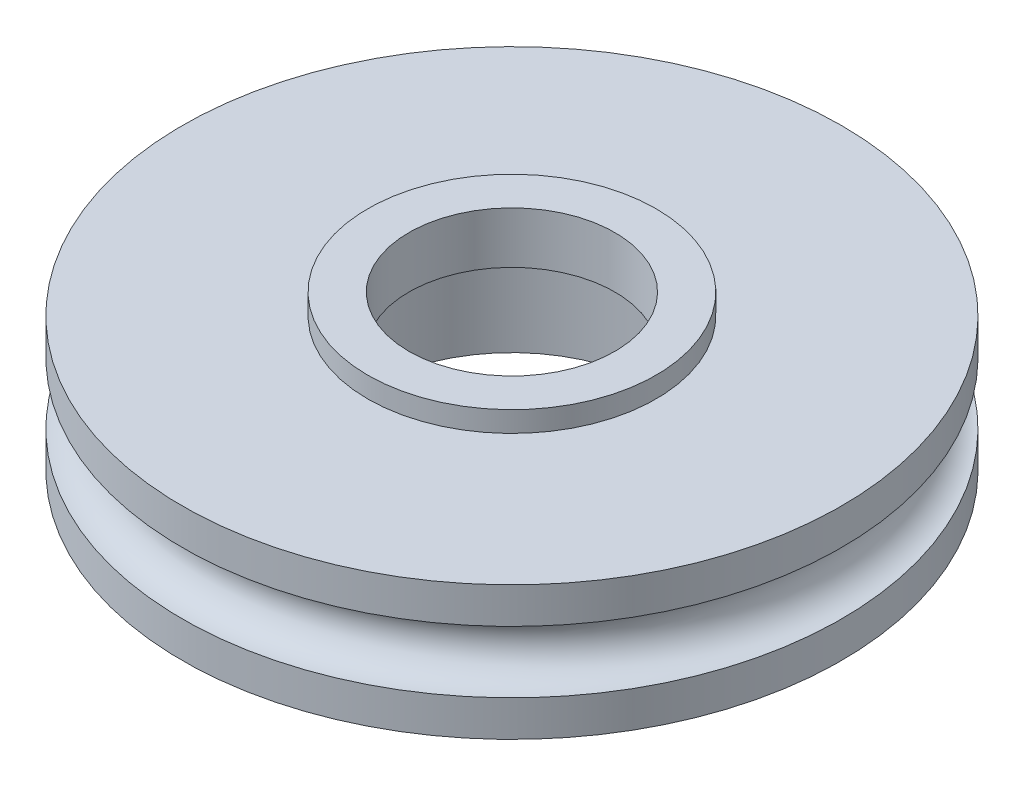
from build123d import *

# Parameters (mm, degrees)
SKETCH1_R           = 8
SKETCH1_R_2         = 3.5
BOSS_EXTRUDE1_DEPTH = 1.625
BOSS_EXTRUDE2_START = -0.75
SKETCH3_R           = 3.5
SKETCH3_R_2         = 2.5
BOSS_EXTRUDE2_DEPTH = 0.75
SKETCH4_R           = 3.5
SKETCH4_R_2         = 2.5
BOSS_EXTRUDE3_DEPTH = 0.5


with BuildPart() as part:
    # Sketch1 → Boss-Extrude1 (new, symmetric)
    with BuildSketch(Plane(origin=(0, 0, 0), x_dir=(1, 0, 0), z_dir=(0, 1, 0))):
        with Locations(Location((0, 0, 0), (0, 0, 90))):
            Circle(SKETCH1_R)
        with Locations(Location((0, 0, 0), (0, 0, 90))):
            Circle(SKETCH1_R_2, mode=Mode.SUBTRACT)
    extrude(amount=BOSS_EXTRUDE1_DEPTH, both=True)

    # Sketch2 → Cut-Revolve1 (revolve, cut)
    with BuildSketch(Plane(origin=(0, 0, 0), x_dir=(0, 0, -1), z_dir=(1, 0, 0)), mode=Mode.PRIVATE) as cut_revolve1_sk:
        with BuildLine():
            Line((-8, 0.75), (-8, -0.75))
            ThreePointArc((-8, -0.75), (-7.25, 0), (-8, 0.75))
        make_face()
    revolve(cut_revolve1_sk.sketch.rotate(Axis((0, 1.625, 0), (0, -1, 0)), 180), axis=Axis((0, 1.625, 0), (0, -1, 0)), mode=Mode.SUBTRACT)

    # Sketch3 → Boss-Extrude2 (add)
    with BuildSketch(Plane(origin=(0, 1.625, 0), x_dir=(1, 0, 0), z_dir=(0, 1, 0)).offset(BOSS_EXTRUDE2_START)):
        with Locations(Location((0, 0, 0), (0, 0, 90))):
            Circle(SKETCH3_R)
        with Locations(Location((0, 0, 0), (0, 0, 270))):
            Circle(SKETCH3_R_2, mode=Mode.SUBTRACT)
    extrude(amount=BOSS_EXTRUDE2_DEPTH)

    # Sketch4 → Boss-Extrude3 (add)
    with BuildSketch(Plane(origin=(0, 1.625, 0), x_dir=(1, 0, 0), z_dir=(0, 1, 0))):
        with Locations(Location((0, 0, 0), (0, 0, 90))):
            Circle(SKETCH4_R)
        with Locations(Location((0, 0, 0), (0, 0, 270))):
            Circle(SKETCH4_R_2, mode=Mode.SUBTRACT)
    extrude(amount=BOSS_EXTRUDE3_DEPTH)


solid = part.part
